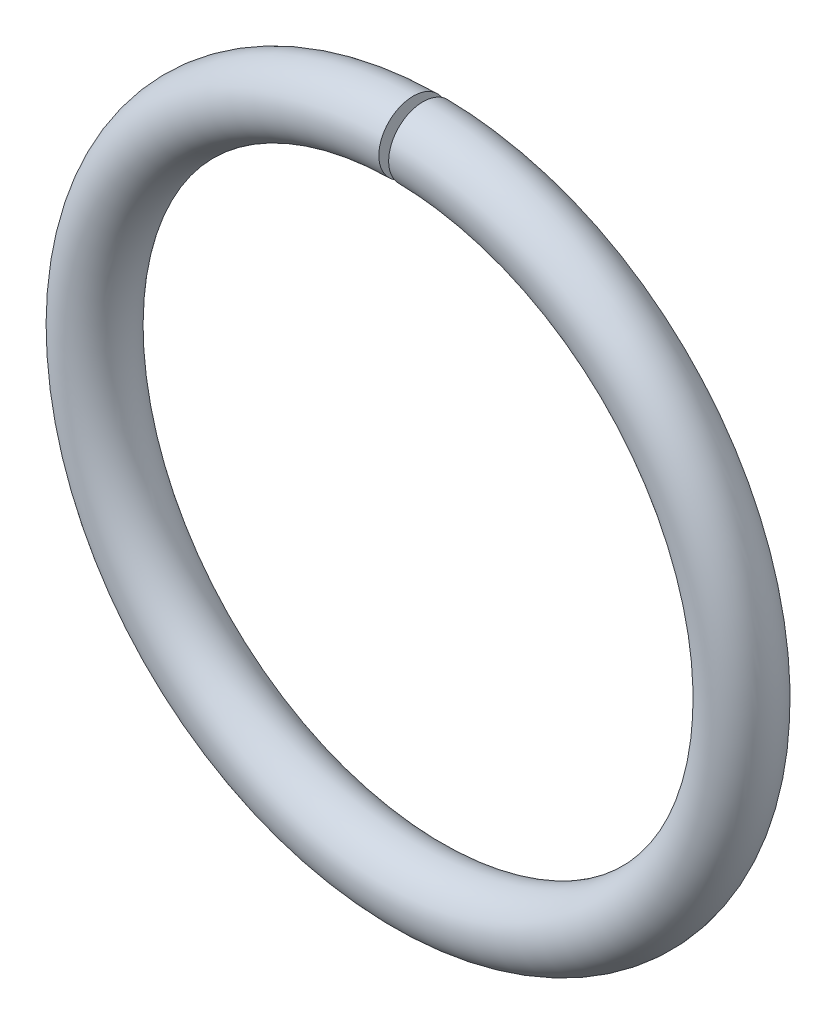
from build123d import *

# Parameters (mm, degrees)
SKETCH_1_R               = 0.7
CUT_EXTRUDE_1_DEPTH      = 11.347463605
CUT_EXTRUDE_1_DEPTH_BACK = 11.347463605
SKETCH_2_W               = 0.2
SKETCH_2_H               = 2.617500795


with BuildPart() as part:
    # Эскиз1 → Повернуть1 (revolve)
    with BuildSketch(Plane(origin=(0, 0, 0), x_dir=(0, 0, -1), z_dir=(1, 0, 0))):
        with Locations((0, 6.6)):
            Circle(SKETCH_1_R)
    revolve(axis=Axis((0, 0, 0), (0, 0, -1)))

    # Эскиз2 → Вытянуть1 (cut, two sides: drawn at the far end of the back side and taken through both)
    with BuildSketch(Plane.XY.offset(-CUT_EXTRUDE_1_DEPTH_BACK)):
        with Locations((0, 6.349026052)):
            Rectangle(SKETCH_2_W, SKETCH_2_H)
    extrude(amount=CUT_EXTRUDE_1_DEPTH + CUT_EXTRUDE_1_DEPTH_BACK, mode=Mode.SUBTRACT)


solid = part.part
